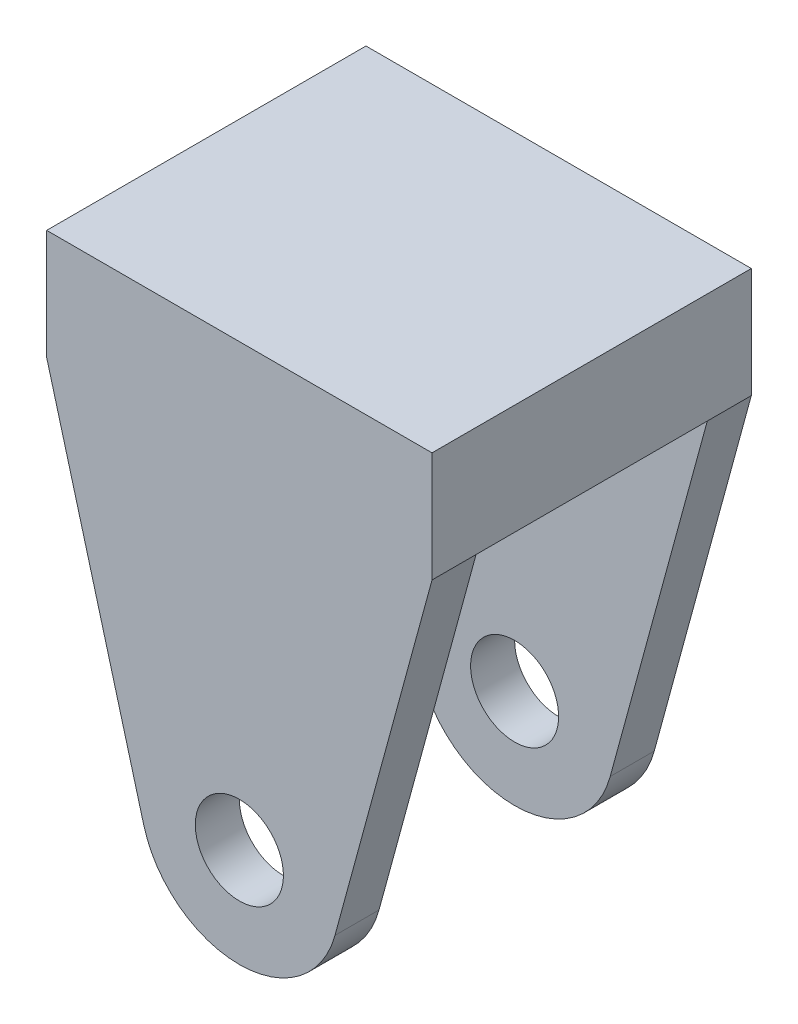
from build123d import *

# Parameters (mm, degrees)
SKETCH_1_R          = 8
EXTRUDE_1_DEPTH     = 29
CUT_EXTRUDE_1_DEPTH = 21


with BuildPart() as part:
    # 草图1 → 凸台-拉伸1 (new, symmetric)
    with BuildSketch(Plane.XY):
        with BuildLine():
            Line((35, 60), (17.367283762, -4.730856402))
            ThreePointArc((17.367283762, -4.730856402), (0, -18.000098543), (-17.367283762, -4.730856402))
            Line((-17.367283762, -4.730856402), (-35, 60))
            Line((-35, 60), (-35, 80))
            Line((-35, 80), (35, 80))
            Line((35, 80), (35, 60))
        make_face()
        with Locations(Location((0, 0, 0), (0, 0, 180))):
            Circle(SKETCH_1_R, mode=Mode.SUBTRACT)
    extrude(amount=EXTRUDE_1_DEPTH, both=True)

    # 草图2 → 切除-拉伸1 (cut, symmetric)
    with BuildSketch(Plane.XY):
        with BuildLine():
            Line((-35, 60), (35, 60))
            Line((35, 60), (17.367283762, -4.730856402))
            ThreePointArc((17.367283762, -4.730856402), (0, -18.000098543), (-17.367283762, -4.730856402))
            Line((-17.367283762, -4.730856402), (-35, 60))
        make_face()
    extrude(amount=CUT_EXTRUDE_1_DEPTH, both=True, mode=Mode.SUBTRACT)


solid = part.part
